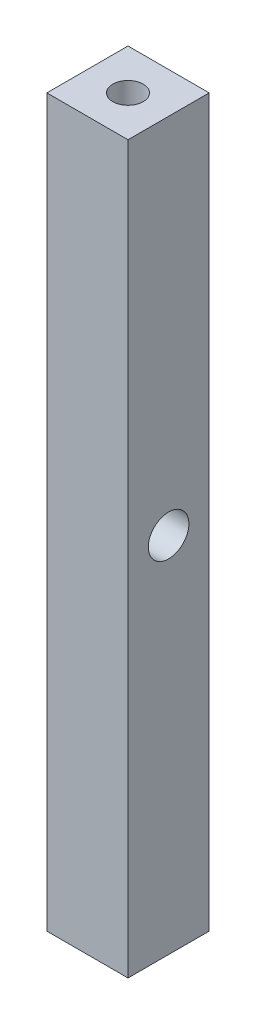
from build123d import *

# Parameters (mm, degrees)
SKETCH1_W           = 8
SKETCH1_H           = 8
SKETCH1_R           = 1.5
BOSS_EXTRUDE1_DEPTH = 71.54
CUT_EXTRUDE1_REACH  = 74.097
SKETCH2_R           = 2


with BuildPart() as part:
    # Sketch1 → Boss-Extrude1 (new body)
    with BuildSketch(Plane(origin=(0, 0, 0), x_dir=(1, 0, 0), z_dir=(0, 1, 0))):
        Rectangle(SKETCH1_W, SKETCH1_H)
        with Locations(Location((0, 0, 0), (0, 0, 270))):
            Circle(SKETCH1_R, mode=Mode.SUBTRACT)
    extrude(amount=BOSS_EXTRUDE1_DEPTH)

    # Sketch2 → Cut-Extrude1 (cut, up to next)
    with BuildSketch(Plane(origin=(4, 0, 0), x_dir=(0, 0, -1), z_dir=(1, 0, 0)), mode=Mode.PRIVATE) as cut_extrude1_sk1:
        with Locations((0, 35.77)):
            Circle(SKETCH2_R)
    cut_extrude1_tool1 = extrude(cut_extrude1_sk1.sketch, amount=-CUT_EXTRUDE1_REACH, mode=Mode.PRIVATE) & part.part
    add(cut_extrude1_tool1.solids().sort_by_distance((4, 35.77, 0))[0], mode=Mode.SUBTRACT)


solid = part.part
